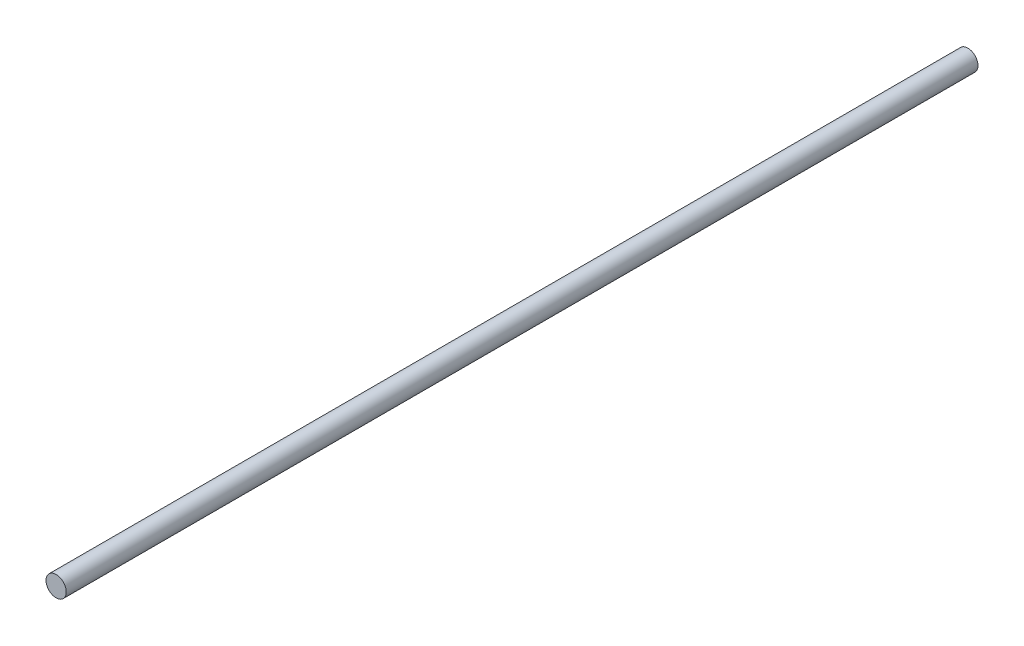
from build123d import *

# Parameters (mm, degrees)
SKETCH1_R           = 1.5
BOSS_EXTRUDE1_DEPTH = 135


with BuildPart() as part:
    # Sketch1 → Boss-Extrude1 (new body)
    with BuildSketch(Plane.XY):
        Circle(SKETCH1_R)
    extrude(amount=BOSS_EXTRUDE1_DEPTH)


solid = part.part
